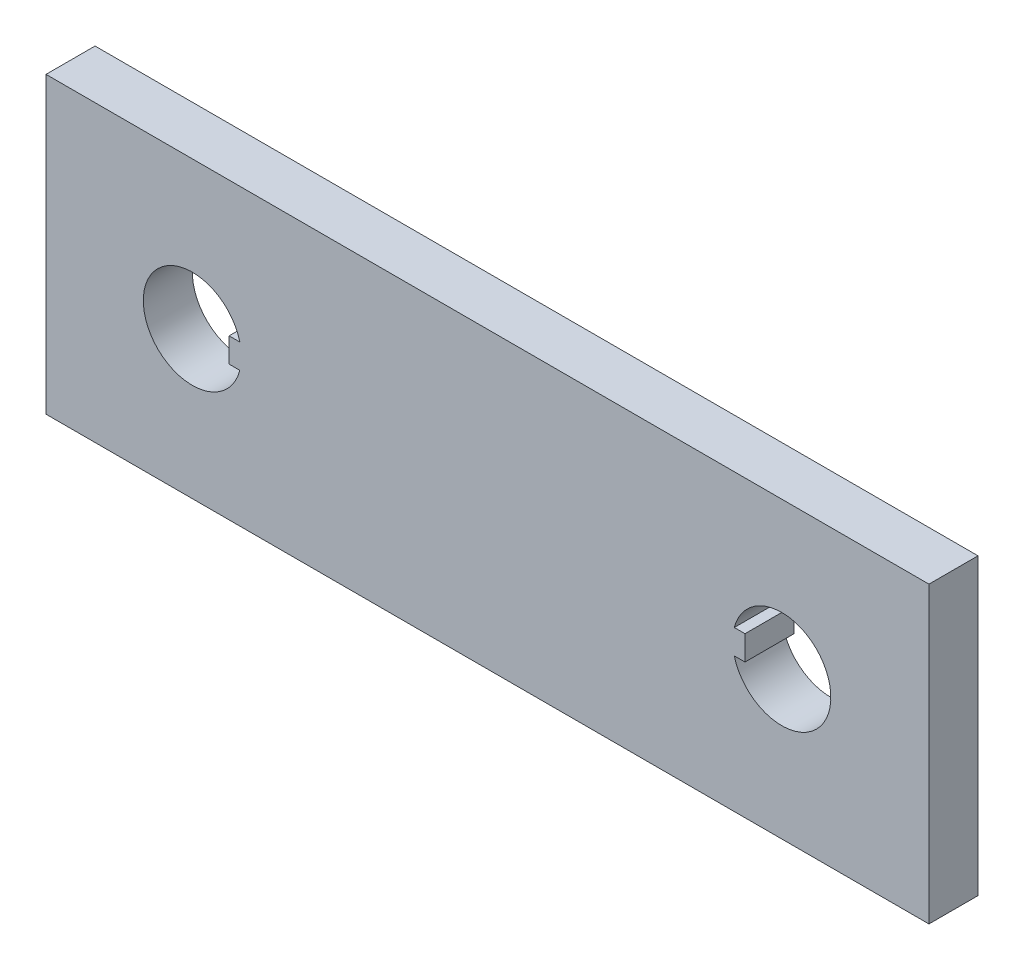
from build123d import *

# Parameters (mm, degrees)
SKETCH1_W           = 114.3
SKETCH1_H           = 38.1
BOSS_EXTRUDE1_DEPTH = 6.35
CUT_EXTRUDE1_DEPTH  = 61.57513929


with BuildPart() as part:
    # Sketch1 → Boss-Extrude1 (new body)
    with BuildSketch(Plane.XY):
        Rectangle(SKETCH1_W, SKETCH1_H)
    extrude(amount=BOSS_EXTRUDE1_DEPTH)

    # Sketch2 → Cut-Extrude1 (cut, through all)
    with BuildSketch(Plane.XY.offset(6.35)):
        with BuildLine():
            Line((31.95195085, -1.58870754), (33.3375, -1.58870754))
            Line((33.3375, -1.58870754), (33.3375, 1.58629246))
            Line((33.3375, 1.58629246), (31.951327279, 1.58629246))
            ThreePointArc((31.951327279, 1.58629246), (44.449999878, 0.001247142), (31.95195085, -1.58870754))
        make_face()
        with BuildLine():
            Line((-32.057272724, 1.58870754), (-33.442821874, 1.58870754))
            Line((-33.442821874, 1.58870754), (-33.442821874, -1.58629246))
            Line((-33.442821874, -1.58629246), (-32.056649153, -1.58629246))
            ThreePointArc((-32.056649153, -1.58629246), (-44.555321751, -0.001247142), (-32.057272724, 1.58870754))
        make_face()
    extrude(amount=-CUT_EXTRUDE1_DEPTH, mode=Mode.SUBTRACT)


solid = part.part
